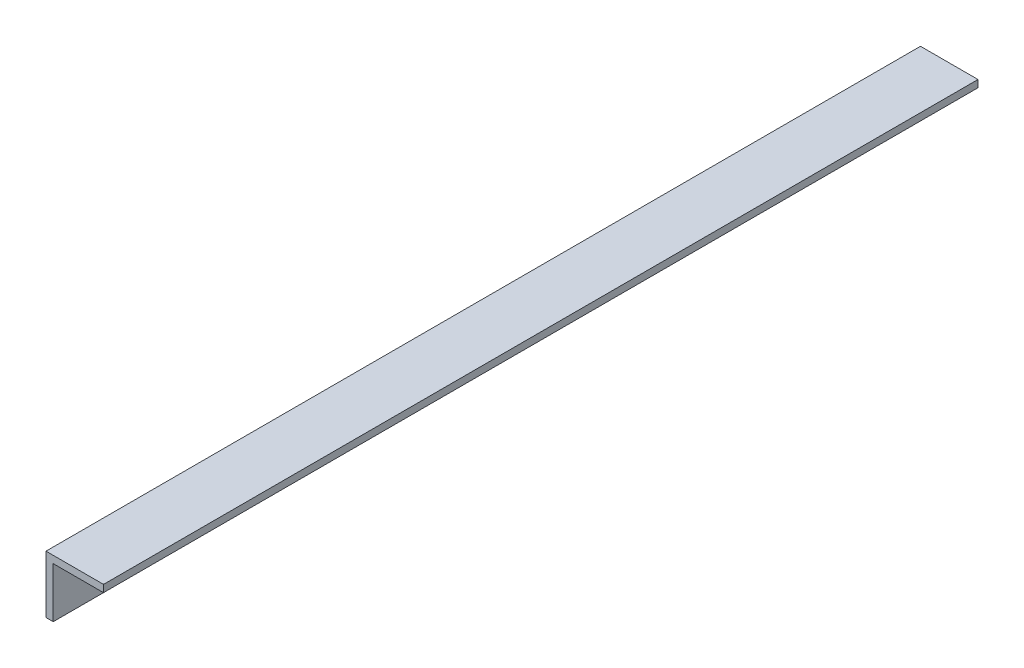
from build123d import *

# Parameters (mm, degrees)
BOSS_EXTRUDE1_DEPTH = 386.08
SKETCH2_R           = 3.96875
CUT_EXTRUDE1_DEPTH  = 6.35


with BuildPart() as part:
    # Sketch1 → Boss-Extrude1 (new body)
    with BuildSketch(Plane.XY):
        Polygon((0, 0), (0, 25.4), (25.4, 25.4), (25.4, 22.225), (3.175, 22.225), (3.175, 0), align=None)
    extrude(amount=BOSS_EXTRUDE1_DEPTH)

    # Sketch2 → Cut-Extrude1 (cut)
    with BuildSketch(Plane(origin=(3.175, 0, 0), x_dir=(0, 0, -1), z_dir=(1, 0, 0))):
        with Locations(Location((-19.05, 12.7, 0), (0, 0, 90))):
            Circle(SKETCH2_R)
        with Locations(Location((-158.75, 12.7, 0), (0, 0, 90))):
            Circle(SKETCH2_R)
    extrude(amount=-CUT_EXTRUDE1_DEPTH, mode=Mode.SUBTRACT)


solid = part.part
